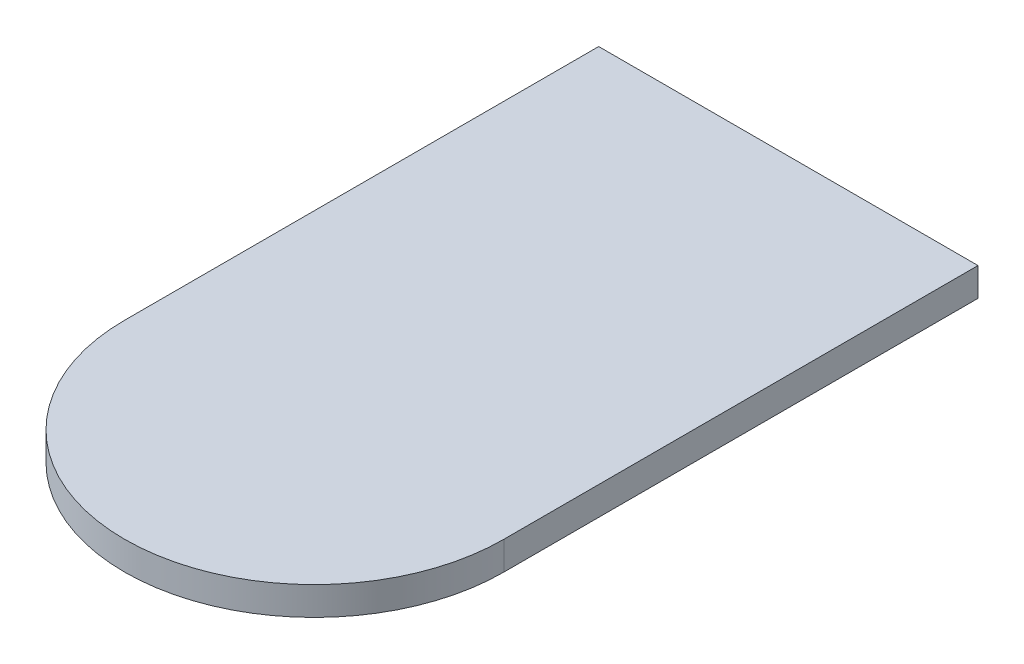
from build123d import *

# Parameters (mm, degrees)
EXTRUDE_1_DEPTH = 1.2


with BuildPart() as part:
    # 草圖1 → 填料-伸長1 (new body)
    with BuildSketch(Plane(origin=(0, 0, 0), x_dir=(1, 0, 0), z_dir=(0, 1, 0))):
        with BuildLine():
            Line((8, 0), (8, 20))
            Line((8, 20), (-8, 20))
            Line((-8, 20), (-8, 0))
            ThreePointArc((-8, 0), (0, -8), (8, 0))
        make_face()
    extrude(amount=EXTRUDE_1_DEPTH)


solid = part.part
